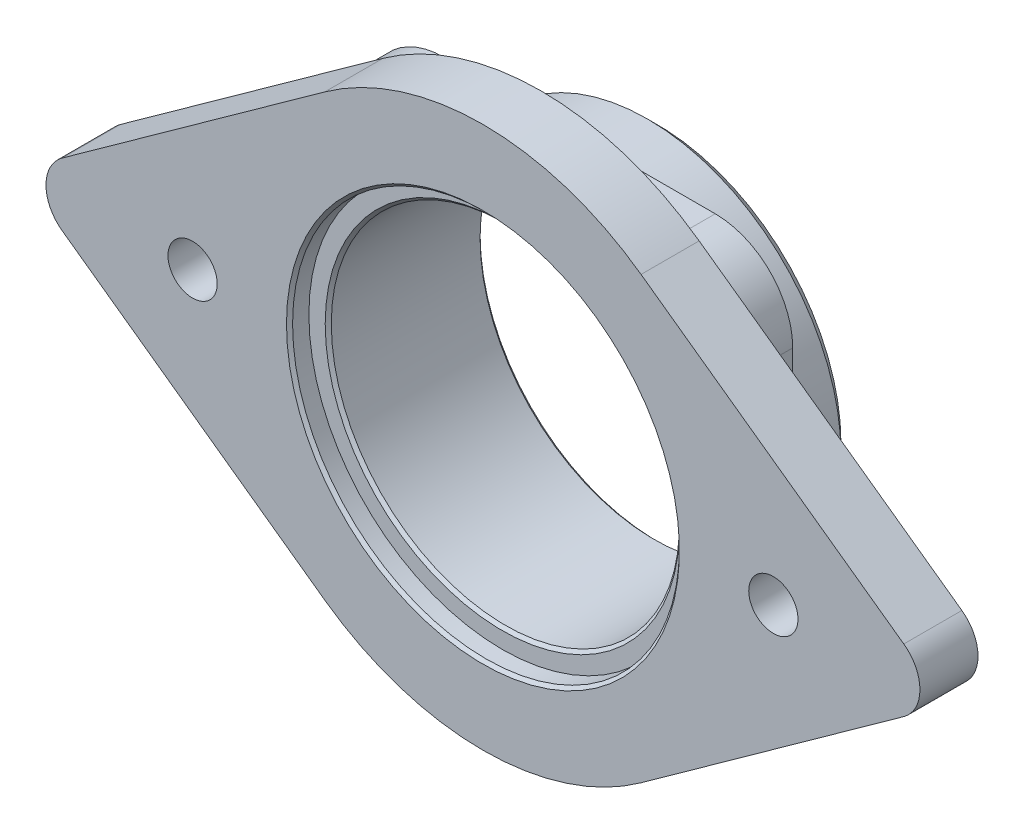
from build123d import *

# Parameters (mm, degrees)
BOSS_EXTRUDE1_DEPTH             = 4.7625
BOSS_EXTRUDE2_DEPTH             = 3.175
SKETCH3_W                       = 15.8623
SKETCH3_H                       = 6.35
M3_5_CLEARANCE_HOLE1_D          = 4.0386
CBORE_FOR_M25_SHSS1_D           = 28.5496
CBORE_FOR_M25_SHSS1_CBORE_D     = 31.7246
CBORE_FOR_M25_SHSS1_CBORE_DEPTH = 1.5875
CHAMFER1_SIZE                   = 0.25
CHAMFER2_SIZE                   = 0.79375
FILLET1_R                       = 22.225


with BuildPart() as part:
    # Sketch1 → Boss-Extrude1 (new body)
    with BuildSketch(Plane(origin=(0, 0, -2.38125), x_dir=(-1, 0, 0), z_dir=(0, 0, -1))):
        with BuildLine():
            Line((-34.50922619, -2.578839337), (0, -27.36284265))
            Line((0, -27.36284265), (34.50922619, -2.578839337))
            ThreePointArc((34.50922619, -2.578839337), (35.832142857, 0), (34.50922619, 2.578839337))
            Line((34.50922619, 2.578839337), (0, 27.36284265))
            Line((0, 27.36284265), (-34.50922619, 2.578839337))
            ThreePointArc((-34.50922619, 2.578839337), (-35.832142857, 0), (-34.50922619, -2.578839337))
        make_face()
    extrude(amount=-BOSS_EXTRUDE1_DEPTH)

    # Sketch2 → Boss-Extrude2 (add)
    with BuildSketch(Plane(origin=(0, 0, -2.38125), x_dir=(-1, 0, 0), z_dir=(0, 0, -1))):
        with BuildLine():
            Line((-17.4625, -11.1125), (-17.4625, 11.1125))
            ThreePointArc((-17.4625, 11.1125), (-15.602628061, 15.602628061), (-11.1125, 17.4625))
            Line((-11.1125, 17.4625), (11.1125, 17.4625))
            ThreePointArc((11.1125, 17.4625), (15.602628061, 15.602628061), (17.4625, 11.1125))
            Line((17.4625, 11.1125), (17.4625, -11.1125))
            ThreePointArc((17.4625, -11.1125), (15.602628061, -15.602628061), (11.1125, -17.4625))
            Line((11.1125, -17.4625), (-11.1125, -17.4625))
            ThreePointArc((-11.1125, -17.4625), (-15.602628061, -15.602628061), (-17.4625, -11.1125))
        make_face()
    extrude(amount=BOSS_EXTRUDE2_DEPTH)

    # Sketch3 → Revolve1 (revolve)
    with BuildSketch(Plane(origin=(0, 0, 0), x_dir=(1, 0, 0), z_dir=(0, 1, 0))):
        with Locations((7.93115, 8.73125)):
            Rectangle(SKETCH3_W, SKETCH3_H)
    revolve(axis=Axis((0, 0, -11.90625), (0, 0, 1)))

    # M3.5 Clearance Hole1 (through all)
    with Locations(Plane(origin=(0, 0, -2.38125), x_dir=(-1, 0, 0), z_dir=(0, 0, -1))):
        with Locations((23.8125, 0), (-23.8125, 0)):
            Hole(M3_5_CLEARANCE_HOLE1_D / 2)

    # CBORE for M25 SHSS1 (through all)
    with Locations(Plane.XY.offset(2.38125)):
        with Locations((0, 0)):
            CounterBoreHole(CBORE_FOR_M25_SHSS1_D / 2, CBORE_FOR_M25_SHSS1_CBORE_D / 2, CBORE_FOR_M25_SHSS1_CBORE_DEPTH)

    # Chamfer1
    chamfer1_edges = [part.edges().sort_by_distance(p)[0] for p in [
        (-15.8623, 0, 2.38125),
        (14.2748, 0, -11.90625),
        (14.2748, 0, 0.79375),
    ]]
    chamfer(chamfer1_edges, length=CHAMFER1_SIZE)

    # Chamfer2
    chamfer2_edges = [part.edges().sort_by_distance(p)[0] for p in [
        (-15.8623, 0, -11.90625),
    ]]
    chamfer(chamfer2_edges, length=CHAMFER2_SIZE)

    # Fillet1
    fillet1_edges = [part.edges().sort_by_distance(p)[0] for p in [
        (0, 27.36284265, 0),
        (0, -27.36284265, 0),
    ]]
    fillet(fillet1_edges, radius=FILLET1_R)


solid = part.part
